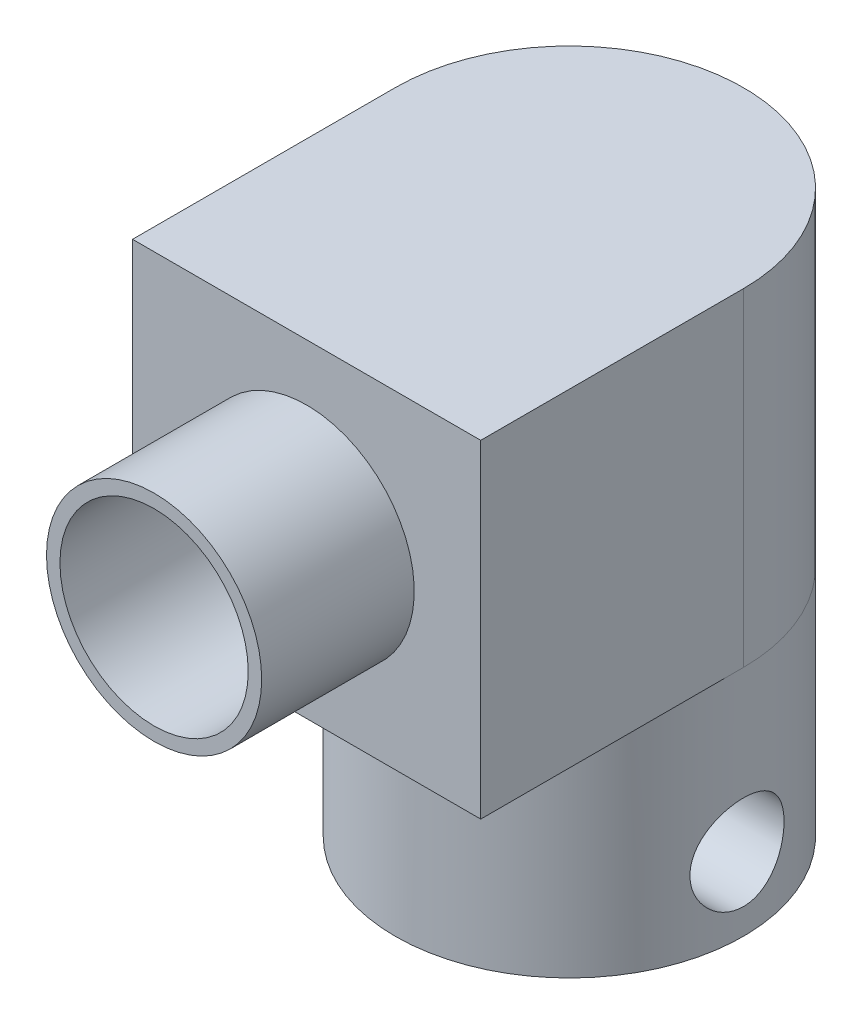
from build123d import *

# Parameters (mm, degrees)
SKETCH1_R        = 20.55
BASE_DEPTH       = 27.4955
TOP_DEPTH        = 38.7223
SKETCH3_R        = 2
MOUNTING_DEPTH   = 6.35
NPTF_DEPTH       = 76.952904361
NPTF_DEPTH_BACK  = 76.952904361
SKETCH4_R        = 5.55625
SKETCH5_R        = 12.7
SKETCH5_R_2      = 11.1125
CABLE_TUBE_DEPTH = 18.0086


with BuildPart() as part:
    # Sketch1 → BASE (new body)
    with BuildSketch(Plane(origin=(0, 0, 0), x_dir=(1, 0, 0), z_dir=(0, 1, 0))):
        with Locations(Location((0, 0, 0), (0, 0, 270))):
            Circle(SKETCH1_R)
    extrude(amount=BASE_DEPTH)

    # Sketch2 → TOP (add)
    with BuildSketch(Plane(origin=(0, 27.4955, 0), x_dir=(1, 0, 0), z_dir=(0, 1, 0))):
        with BuildLine():
            Line((-20.55, 0), (-20.55, -31.012))
            Line((-20.55, -31.012), (20.55, -31.012))
            Line((20.55, -31.012), (20.55, 0))
            ThreePointArc((20.55, 0), (0, 20.55), (-20.55, 0))
        make_face()
    extrude(amount=TOP_DEPTH)

    # Sketch3 → MOUNTING (cut)
    with BuildSketch(Plane.XZ):
        with Locations(Location((11.2, 11.2, 0), (0, 0, 270))):
            Circle(SKETCH3_R)
        with Locations(Location((-11.2, -11.2, 0), (0, 0, 270))):
            Circle(SKETCH3_R)
    extrude(amount=-MOUNTING_DEPTH, mode=Mode.SUBTRACT)

    # Sketch4 → NPTF (cut, two sides: drawn at the far end of the back side and taken through both)
    with BuildSketch(Plane(origin=(0, 0, 0), x_dir=(0, 0, -1), z_dir=(1, 0, 0)).offset(-NPTF_DEPTH_BACK)):
        with Locations((0, 8.6)):
            Circle(SKETCH4_R)
    extrude(amount=NPTF_DEPTH + NPTF_DEPTH_BACK, mode=Mode.SUBTRACT)

    # Sketch5 → CABLE_TUBE (add)
    with BuildSketch(Plane.XY.offset(31.012)):
        with Locations(Location((0, 46.85665, 0), (0, 0, 180))):
            Circle(SKETCH5_R)
        with Locations((0, 46.85665)):
            Circle(SKETCH5_R_2, mode=Mode.SUBTRACT)
    extrude(amount=CABLE_TUBE_DEPTH)


solid = part.part
